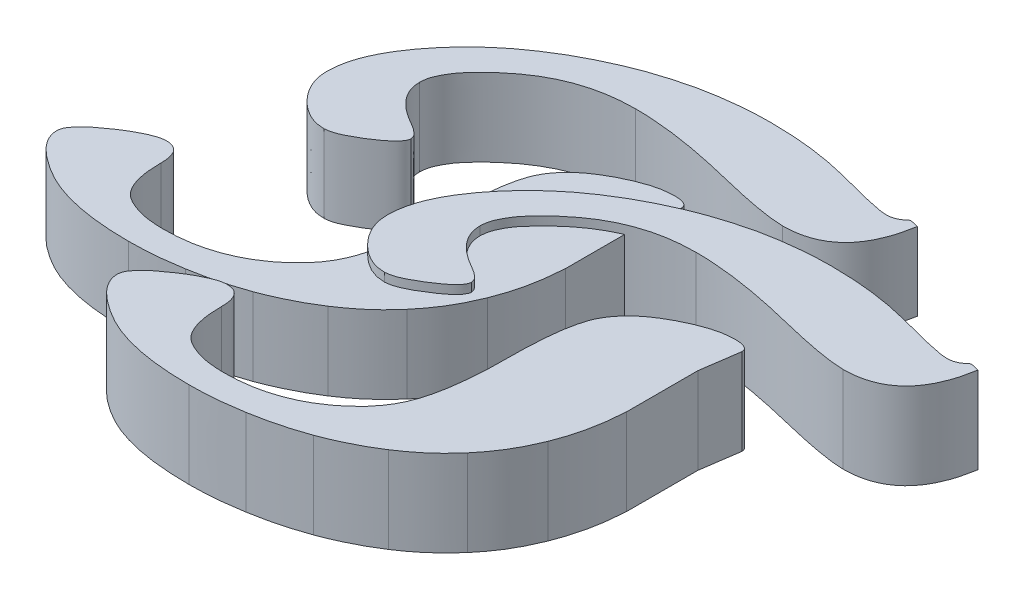
from build123d import *

# Parameters (mm, degrees)
BOSS_EXTRUDE2_DEPTH   = 10
BOSS_EXTRUDE2_2_DEPTH = 10
BOSS_EXTRUDE3_DEPTH   = 9
BOSS_EXTRUDE3_2_DEPTH = 9


with BuildPart() as part:
    # Sketch1 → Boss-Extrude2 (new body)
    with BuildSketch(Plane(origin=(0, 0, 0), x_dir=(1, 0, 0), z_dir=(0, 1, 0))):
        with BuildLine():
            add(Edge.make_bspline(
                [(32.296176809, 32.676124234), (32.238166261, 32.362750175), (32.125346395, 31.753295167), (31.918169907, 30.870525827), (31.653744835, 30.052202831), (31.351322074, 29.293060452), (31.011130686, 28.589829887), (30.613068251, 27.957544838), (30.191170658, 27.371792563), (29.713248528, 26.857596383), (29.196812469, 26.399925412), (28.63838919, 26.004028107), (28.039337987, 25.669588906), (27.397174124, 25.393875403), (26.712705678, 25.185777569), (25.986873606, 25.032502244), (25.219922734, 24.941268577), (24.692991994, 24.930278259), (24.423595327, 24.92465939)],
                knots=[0, 0, 0, 0, 1.249320145, 2.429698309, 3.551675932, 4.61703294, 5.631541448, 6.608758601, 7.542558368, 8.457255773, 9.354287334, 10.243528633, 11.135114158, 12.039099556, 12.977729995, 13.934803594, 14.944155299, 16, 16, 16, 16], degree=3))
            add(Edge.make_bspline(
                [(24.423595327, 24.92465939), (24.2081891, 24.93307122), (23.732838973, 24.951634122), (22.95055362, 25.022796258), (22.040399533, 25.162411786), (20.991771223, 25.328916324), (19.817026463, 25.570355284), (18.498698173, 25.836444366), (17.054739713, 26.175806838), (15.507320069, 26.53951355), (13.929672651, 26.930908015), (12.364380258, 27.242599757), (10.863260175, 27.536155799), (9.413743971, 27.75023441), (8.022376823, 27.942805655), (6.681141114, 28.054048965), (5.399486584, 28.147444936), (4.563997524, 28.152145267), (4.156744538, 28.154436408)],
                knots=[0, 0, 0, 0, 0.503062706, 1.110139311, 1.831901116, 2.651570933, 3.587805768, 4.63031373, 5.790272806, 7.049123854, 8.340346115, 9.583030205, 10.773416163, 11.909423871, 13.00214145, 14.05066393, 15.049810495, 16, 16, 16, 16], degree=3))
            add(Edge.make_bspline(
                [(4.156744538, 28.154436408), (3.651701269, 28.141436225), (2.659222586, 28.115889099), (1.19313467, 27.954436634), (-0.218090704, 27.672370302), (-1.581249437, 27.274490699), (-2.893580495, 26.77301407), (-4.151929459, 26.151760938), (-5.357914742, 25.423045614), (-6.486956607, 24.594864806), (-7.51920137, 23.725067489), (-8.441654616, 22.877774356), (-9.206562709, 22.042223287), (-9.863142886, 21.26068495), (-10.342789632, 20.478248024), (-10.707808789, 19.739462766), (-10.938462023, 19.020416481), (-10.968377124, 18.543975666), (-10.982835235, 18.313709556)],
                knots=[0, 0, 0, 0, 1.250848759, 2.458087861, 3.647715622, 4.810575582, 5.971134652, 7.122594925, 8.281507705, 9.45648421, 10.586275448, 11.623842744, 12.555425394, 13.390863396, 14.146904561, 14.821463036, 15.430407483, 16, 16, 16, 16], degree=3))
            add(Edge.make_bspline(
                [(-10.982835235, 18.313709556), (-10.970943304, 18.097141678), (-10.947336316, 17.66722703), (-10.762545972, 17.036673283), (-10.476345806, 16.422341503), (-10.068916509, 15.827835985), (-9.540944745, 15.25637466), (-8.902560688, 14.704714866), (-8.152281393, 14.167686331), (-7.597945077, 13.847772501), (-7.308963877, 13.680998145)],
                knots=[0, 0, 0, 0, 0.836688663, 1.66093289, 2.522757717, 3.45056617, 4.436450929, 5.524996317, 6.709755229, 8, 8, 8, 8], degree=3))
            add(Edge.make_bspline(
                [(-7.308963877, 13.680998145), (-7.084942257, 13.549664088), (-6.68512226, 13.315267148), (-6.220337144, 12.918834608), (-5.882592097, 12.555301125), (-5.835854191, 12.279066597), (-5.815192006, 12.156947115)],
                knots=[0, 0, 0, 0, 1.404279751, 2.506272058, 3.339643434, 4, 4, 4, 4], degree=3))
            add(Edge.make_bspline(
                [(-5.815192006, 12.156947115), (-5.824432421, 12.075104537), (-5.844045731, 11.901388968), (-5.970850083, 11.63841996), (-6.165230171, 11.360374661), (-6.427979686, 11.057589798), (-6.771933214, 10.743951559), (-7.180551318, 10.399286899), (-7.683090414, 10.053532041), (-8.398308473, 9.559576816), (-9.284127823, 9.034506197), (-10.258301808, 8.534890751), (-11.091297017, 8.213235145), (-11.613492601, 8.155112884), (-11.840744756, 8.129818895)],
                knots=[0, 0, 0, 0, 0.391847711, 0.831719262, 1.376672458, 2.01601642, 2.745194141, 3.602994313, 4.572767921, 5.662674314, 7.764525838, 9.493078839, 10.909023264, 12, 12, 12, 12], degree=3))
            add(Edge.make_bspline(
                [(-11.840744756, 8.129818895), (-12.180546023, 8.14936491), (-12.865478576, 8.188763534), (-13.855737001, 8.576684458), (-14.809218315, 9.163693135), (-15.689717813, 9.959429003), (-16.454604085, 10.880297187), (-17.022700194, 11.883331703), (-17.378647023, 12.934120706), (-17.421184052, 13.654801073), (-17.442389272, 14.0140689)],
                knots=[0, 0, 0, 0, 0.914633543, 1.843613749, 2.835295667, 3.930056909, 5.034776709, 6.056468476, 7.031126171, 8, 8, 8, 8], degree=3))
            add(Edge.make_bspline(
                [(-17.442389272, 14.0140689), (-17.42733724, 14.371530241), (-17.396582983, 15.101893971), (-17.186019114, 16.206746749), (-16.839182199, 17.332920035), (-16.346440911, 18.479856507), (-15.716779551, 19.648269093), (-14.953734689, 20.845223122), (-14.05250807, 22.062149823), (-13.031140743, 23.29469322), (-11.89654551, 24.509187236), (-10.665725852, 25.677795932), (-9.350238179, 26.792653216), (-7.945656674, 27.840635317), (-6.45655459, 28.828923043), (-4.890949982, 29.772273527), (-3.234675613, 30.647589018), (-1.505069273, 31.457893498), (0.269462317, 32.210938543), (2.090841778, 32.839992298), (3.929372689, 33.386332633), (5.786421911, 33.846248352), (7.668105581, 34.187313511), (9.568677063, 34.425698906), (11.491655122, 34.586151737), (12.782617546, 34.604671075), (13.432260412, 34.613990445)],
                knots=[0, 0, 0, 0, 0.641824347, 1.311373201, 2.012767159, 2.754530311, 3.54920331, 4.393952296, 5.301468113, 6.266888195, 7.267164367, 8.284268289, 9.31314753, 10.362002438, 11.429417095, 12.521527533, 13.643170267, 14.791825037, 15.950919461, 17.10312799, 18.250113145, 19.394565389, 20.536958502, 21.682032545, 22.83354388, 24, 24, 24, 24], degree=3))
            add(Edge.make_bspline(
                [(13.432260412, 34.613990445), (14.300861008, 34.598953549), (16.017941877, 34.569228073), (18.556646898, 34.318369937), (21.026570305, 33.922142118), (23.011336189, 33.438493456), (24.513226125, 33.02829508), (25.528604405, 32.762924255), (26.430960989, 32.543427092), (27.224124501, 32.357774042), (27.907309121, 32.21580575), (28.479453838, 32.115579137), (28.940291138, 32.046272547), (29.210904031, 32.035056179), (29.328819174, 32.03016883)],
                knots=[0, 0, 0, 0, 1.934990464, 3.82515868, 5.678685825, 7.504245759, 8.373435701, 9.147995091, 9.842531944, 10.442615453, 10.963059397, 11.396877843, 11.737199382, 12, 12, 12, 12], degree=3))
            add(Edge.make_bspline(
                [(29.328819174, 32.03016883), (29.498175031, 32.039991977), (29.829586266, 32.059214821), (30.307339777, 32.208731111), (30.751097845, 32.448794741), (30.992490795, 32.686441072), (31.115289587, 32.807333925)],
                knots=[0, 0, 0, 0, 1.012239635, 1.980844312, 2.972837109, 4, 4, 4, 4], degree=3))
            Line((31.115289587, 32.807333925), (31.37770897, 32.877985297))
            Line((31.37770897, 32.877985297), (32.296176809, 32.676124234))
        make_face()
    extrude(amount=BOSS_EXTRUDE2_DEPTH)


with BuildPart() as body_2:
    # Sketch1 → Boss-Extrude2 2 (new body)
    with BuildSketch(Plane(origin=(0, 0, 0), x_dir=(1, 0, 0), z_dir=(0, 1, 0))):
        with BuildLine():
            add(Edge.make_bspline(
                [(15.127893347, 21.694882372), (15.371874828, 21.688748966), (15.799774863, 21.677992067), (16.343160786, 21.533642548), (16.734760258, 21.255529225), (16.77427564, 20.986378989), (16.793247122, 20.857158958)],
                knots=[0, 0, 0, 0, 1.412379978, 2.477062757, 3.268832157, 4, 4, 4, 4], degree=3))
            Line((16.793247122, 20.857158958), (16.147291718, 16.396029451))
            Line((16.147291718, 16.396029451), (16.147291718, 8.109632789))
            add(Edge.make_bspline(
                [(16.147291718, 8.109632789), (16.097109518, 7.445688333), (15.998050209, 6.135066664), (15.672169815, 4.216989089), (15.201982666, 2.37512701), (14.768033341, 1.202676892), (14.552589315, 0.620587328)],
                knots=[0, 0, 0, 0, 1.038589385, 2.050168118, 3.031961554, 4, 4, 4, 4], degree=3))
            add(Edge.make_bspline(
                [(14.552589315, 0.620587328), (14.328106577, 0.098882428), (13.879824016, -0.942940257), (13.070657676, -2.439918422), (12.130133637, -3.861519856), (11.411222571, -4.741255192), (11.050299861, -5.182918252)],
                knots=[0, 0, 0, 0, 1.000725729, 1.998407084, 2.995118626, 4, 4, 4, 4], degree=3))
            add(Edge.make_bspline(
                [(11.050299861, -5.182918252), (10.699888853, -5.579153015), (9.994519653, -6.376764367), (8.813464341, -7.473386283), (7.542414973, -8.51098598), (6.627829585, -9.129408667), (6.165262121, -9.442186695)],
                knots=[0, 0, 0, 0, 0.975523019, 1.963705119, 2.970108456, 4, 4, 4, 4], degree=3))
            add(Edge.make_bspline(
                [(6.165262121, -9.442186695), (5.718258972, -9.724694938), (4.820680779, -10.291968881), (3.391056744, -11.029756076), (1.917782929, -11.736925477), (0.889595167, -12.130576373), (0.371849595, -12.328799905)],
                knots=[0, 0, 0, 0, 0.977965645, 1.963745983, 2.97464107, 4, 4, 4, 4], degree=3))
            add(Edge.make_bspline(
                [(0.371849595, -12.328799905), (-0.124370529, -12.502382937), (-1.119305532, -12.850421694), (-2.651429148, -13.277897584), (-4.214977317, -13.659392132), (-5.279080701, -13.848442163), (-5.815192006, -13.943688414)],
                knots=[0, 0, 0, 0, 0.985008729, 1.974969608, 2.979759202, 4, 4, 4, 4], degree=3))
            add(Edge.make_bspline(
                [(-5.815192006, -13.943688414), (-6.822500333, -14.100970914), (-8.839193246, -14.415860103), (-10.879899471, -14.457685836), (-11.901303075, -14.478620233)],
                knots=[0, 0, 0, 0, 0.998970464, 2, 2, 2, 2], degree=3))
            add(Edge.make_bspline(
                [(-11.901303075, -14.478620233), (-12.480176912, -14.470704678), (-13.605376856, -14.455318627), (-15.245514821, -14.341092255), (-16.790118121, -14.167032707), (-18.238666331, -13.901732605), (-19.591594707, -13.572339406), (-20.852245827, -13.17012168), (-22.013837238, -12.687050329), (-23.070328177, -12.132969476), (-24.006837082, -11.540551764), (-24.829943482, -10.954997509), (-25.533639973, -10.380517366), (-26.115319952, -9.808167194), (-26.566696045, -9.232111356), (-26.88704443, -8.657431651), (-27.09606742, -8.087129986), (-27.120102644, -7.701036125), (-27.131720326, -7.514413537)],
                knots=[0, 0, 0, 0, 1.549572055, 3.012017952, 4.399547498, 5.708621745, 6.951579616, 8.125080993, 9.247455168, 10.315044149, 11.314626066, 12.211912658, 13.018000142, 13.744032161, 14.392577437, 14.969076894, 15.501692315, 16, 16, 16, 16], degree=3))
            add(Edge.make_bspline(
                [(-27.131720326, -7.514413537), (-27.119397318, -7.402464672), (-27.093289348, -7.165285776), (-26.953194025, -6.802117718), (-26.708511655, -6.42954706), (-26.389048435, -6.025457225), (-25.959413112, -5.614415269), (-25.463644018, -5.154545737), (-24.848568344, -4.701998651), (-24.185178917, -4.215444526), (-23.488546491, -3.758656575), (-22.818025608, -3.343117454), (-22.189357695, -3.00026196), (-21.612264135, -2.712463449), (-21.076388518, -2.48886483), (-20.585363959, -2.323877072), (-20.134377745, -2.226113922), (-19.848294605, -2.212085769), (-19.713326238, -2.205467563)],
                knots=[0, 0, 0, 0, 0.566881924, 1.201016451, 1.940959198, 2.810984592, 3.79578647, 4.938294616, 6.222386566, 7.645938048, 9.092106944, 10.426219881, 11.627197781, 12.705806991, 13.680450689, 14.555929804, 15.318716242, 16, 16, 16, 16], degree=3))
            add(Edge.make_bspline(
                [(-19.713326238, -2.205467563), (-19.567756497, -2.212500373), (-19.28786173, -2.226022736), (-18.899802193, -2.347921951), (-18.570277337, -2.548410677), (-18.297085473, -2.830249838), (-18.103714222, -3.204484362), (-17.946926431, -3.641069834), (-17.874008167, -4.161249804), (-17.862435782, -4.530111541), (-17.856204452, -4.728730859)],
                knots=[0, 0, 0, 0, 0.977841989, 1.880149377, 2.703424499, 3.552150342, 4.484636058, 5.515814062, 6.66235159, 8, 8, 8, 8], degree=3))
            add(Edge.make_bspline(
                [(-17.856204452, -4.728730859), (-17.849965839, -5.055230132), (-17.838046831, -5.679014256), (-17.760498913, -6.570257736), (-17.62256031, -7.371840513), (-17.421099779, -8.086415186), (-17.163522762, -8.712330982), (-16.845320731, -9.250487018), (-16.475700966, -9.700841185), (-15.882741313, -10.169635981), (-15.015814884, -10.595277188), (-13.860795012, -10.990361518), (-12.544639958, -11.201588832), (-11.619346354, -11.232589896), (-11.134231033, -11.248843214)],
                knots=[0, 0, 0, 0, 1.074446753, 2.052754419, 2.941029153, 3.747044831, 4.491390682, 5.161649512, 5.798139074, 6.396408736, 7.634485015, 8.954407516, 10.403248907, 12, 12, 12, 12], degree=3))
            add(Edge.make_bspline(
                [(-11.134231033, -11.248843214), (-10.72685375, -11.240735719), (-9.924045113, -11.224758474), (-8.741220117, -11.10889463), (-7.591620721, -10.935105456), (-6.489216835, -10.654942346), (-5.416365796, -10.326138362), (-4.387644211, -9.905725712), (-3.38578082, -9.429382119), (-2.443046275, -8.857487386), (-1.551516122, -8.250105405), (-0.729731393, -7.604661241), (0.008677127, -6.919802271), (0.690204701, -6.223405259), (1.271798923, -5.477401838), (1.798860659, -4.720118382), (2.225818541, -3.919415263), (2.60238071, -3.085915616), (2.9012705, -2.184003472), (3.166276494, -1.197035182), (3.382749473, -0.110782104), (3.564269173, 1.074642102), (3.703544954, 2.357765076), (3.802160069, 3.738069737), (3.86367673, 5.219098277), (3.874302319, 6.760512157), (3.88365065, 8.291934929), (3.947898049, 9.732183269), (4.033208871, 11.048979408), (4.162584528, 12.237977132), (4.329136667, 13.300492472), (4.543503005, 14.232972705), (4.776382253, 15.043974057), (5.156210727, 15.960092682), (5.809003259, 16.978556756), (6.809241921, 18.088943472), (8.07726221, 19.089770226), (9.53120101, 19.96876657), (11.042402812, 20.714840161), (12.497469683, 21.267229919), (13.84632378, 21.619313374), (14.715655197, 21.670574348), (15.127893347, 21.694882372)],
                knots=[0, 0, 0, 0, 1.015125314, 2.000483102, 2.959920622, 3.909636101, 4.832506888, 5.754272371, 6.676800275, 7.594246183, 8.498959351, 9.364554068, 10.195377292, 11.007846263, 11.789621579, 12.550108005, 13.30428169, 14.047515556, 14.827084435, 15.669128977, 16.593293953, 17.585867451, 18.657198543, 19.808983909, 21.034210445, 22.350744211, 23.650509584, 24.850603124, 25.943247275, 26.938650033, 27.83052752, 28.621778163, 29.322104324, 29.93097632, 31.087300309, 32.316336844, 33.640246206, 35.097021958, 36.544501828, 37.834030638, 38.97289436, 40, 40, 40, 40], degree=3))
        make_face()
    extrude(amount=BOSS_EXTRUDE2_2_DEPTH)


with BuildPart() as body_3:
    # Sketch2 → Boss-Extrude3 (new body)
    with BuildSketch(Plane(origin=(0, 0, 0), x_dir=(1, 0, 0), z_dir=(0, 1, 0))):
        with BuildLine():
            add(Edge.make_bspline(
                [(13.400044479, 44.562090394), (13.342033931, 44.248716336), (13.229214065, 43.639261327), (13.022037577, 42.756491987), (12.757612505, 41.938168991), (12.455189744, 41.179026612), (12.114998356, 40.475796047), (11.716935921, 39.843510999), (11.295038328, 39.257758724), (10.817116198, 38.743562543), (10.300680139, 38.285891572), (9.74225686, 37.889994268), (9.143205658, 37.555555066), (8.501041794, 37.279841563), (7.816573348, 37.071743729), (7.090741277, 36.918468404), (6.323790404, 36.827234737), (5.796859665, 36.81624442), (5.527462998, 36.81062555)],
                knots=[0, 0, 0, 0, 1.249320145, 2.429698309, 3.551675932, 4.61703294, 5.631541448, 6.608758601, 7.542558368, 8.457255773, 9.354287334, 10.243528633, 11.135114158, 12.039099556, 12.977729995, 13.934803594, 14.944155299, 16, 16, 16, 16], degree=3))
            add(Edge.make_bspline(
                [(5.527462998, 36.81062555), (5.31205677, 36.819037381), (4.836706643, 36.837600282), (4.05442129, 36.908762419), (3.144267203, 37.048377946), (2.095638894, 37.214882484), (0.920894133, 37.456321444), (-0.397434156, 37.722410527), (-1.841392617, 38.061772998), (-3.38881226, 38.42547971), (-4.966459679, 38.816874175), (-6.531752072, 39.128565918), (-8.032872154, 39.422121959), (-9.482388359, 39.63620057), (-10.873755507, 39.828771815), (-12.214991216, 39.940015126), (-13.496645746, 40.033411097), (-14.332134805, 40.038111427), (-14.739387792, 40.040402568)],
                knots=[0, 0, 0, 0, 0.503062706, 1.110139311, 1.831901116, 2.651570933, 3.587805768, 4.63031373, 5.790272806, 7.049123854, 8.340346115, 9.583030205, 10.773416163, 11.909423871, 13.00214145, 14.05066393, 15.049810495, 16, 16, 16, 16], degree=3))
            add(Edge.make_bspline(
                [(-14.739387792, 40.040402568), (-15.244431061, 40.027402386), (-16.236909743, 40.00185526), (-17.70299766, 39.840402794), (-19.114223034, 39.558336463), (-20.477381767, 39.160456859), (-21.789712825, 38.658980231), (-23.048061789, 38.037727099), (-24.254047071, 37.309011775), (-25.383088937, 36.480830966), (-26.4153337, 35.611033649), (-27.337786945, 34.763740516), (-28.102695039, 33.928189448), (-28.759275216, 33.14665111), (-29.238921962, 32.364214184), (-29.603941118, 31.625428927), (-29.834594352, 30.906382641), (-29.864509454, 30.429941827), (-29.878967565, 30.199675716)],
                knots=[0, 0, 0, 0, 1.250848759, 2.458087861, 3.647715622, 4.810575582, 5.971134652, 7.122594925, 8.281507705, 9.45648421, 10.586275448, 11.623842744, 12.555425394, 13.390863396, 14.146904561, 14.821463036, 15.430407483, 16, 16, 16, 16], degree=3))
            add(Edge.make_bspline(
                [(-29.878967565, 30.199675716), (-29.867075634, 29.983107838), (-29.843468645, 29.55319319), (-29.658678302, 28.922639443), (-29.372478136, 28.308307663), (-28.965048839, 27.713802146), (-28.437077075, 27.142340821), (-27.798693017, 26.590681027), (-27.048413723, 26.053652491), (-26.494077406, 25.733738662), (-26.205096207, 25.566964305)],
                knots=[0, 0, 0, 0, 0.836688663, 1.66093289, 2.522757717, 3.45056617, 4.436450929, 5.524996317, 6.709755229, 8, 8, 8, 8], degree=3))
            add(Edge.make_bspline(
                [(-26.205096207, 25.566964305), (-25.981074587, 25.435630249), (-25.58125459, 25.201233309), (-25.116469474, 24.804800768), (-24.778724427, 24.441267285), (-24.731986521, 24.165032758), (-24.711324336, 24.042913275)],
                knots=[0, 0, 0, 0, 1.404279751, 2.506272058, 3.339643434, 4, 4, 4, 4], degree=3))
            add(Edge.make_bspline(
                [(-24.711324336, 24.042913275), (-24.72056475, 23.961070698), (-24.740178061, 23.787355129), (-24.866982412, 23.52438612), (-25.0613625, 23.246340822), (-25.324112015, 22.943555958), (-25.668065543, 22.629917719), (-26.076683648, 22.28525306), (-26.579222743, 21.939498201), (-27.294440802, 21.445542976), (-28.180260153, 20.920472357), (-29.154434138, 20.420856911), (-29.987429347, 20.099201306), (-30.509624931, 20.041079044), (-30.736877085, 20.015785055)],
                knots=[0, 0, 0, 0, 0.391847711, 0.831719262, 1.376672458, 2.01601642, 2.745194141, 3.602994313, 4.572767921, 5.662674314, 7.764525838, 9.493078839, 10.909023264, 12, 12, 12, 12], degree=3))
            add(Edge.make_bspline(
                [(-30.736877085, 20.015785055), (-31.076678353, 20.035331071), (-31.761610906, 20.074729694), (-32.75186933, 20.462650618), (-33.705350645, 21.049659295), (-34.585850142, 21.845395164), (-35.350736415, 22.766263347), (-35.918832524, 23.769297863), (-36.274779353, 24.820086867), (-36.317316381, 25.540767234), (-36.338521601, 25.90003506)],
                knots=[0, 0, 0, 0, 0.914633543, 1.843613749, 2.835295667, 3.930056909, 5.034776709, 6.056468476, 7.031126171, 8, 8, 8, 8], degree=3))
            add(Edge.make_bspline(
                [(-36.338521601, 25.90003506), (-36.32346957, 26.257496402), (-36.292715312, 26.987860131), (-36.082151443, 28.09271291), (-35.735314529, 29.218886195), (-35.242573241, 30.365822668), (-34.612911881, 31.534235253), (-33.849867019, 32.731189282), (-32.9486404, 33.948115983), (-31.927273073, 35.18065938), (-30.792677839, 36.395153396), (-29.561858181, 37.563762093), (-28.246370509, 38.678619377), (-26.841789004, 39.726601477), (-25.35268692, 40.714889204), (-23.787082312, 41.658239688), (-22.130807943, 42.533555179), (-20.401201602, 43.343859658), (-18.626670013, 44.096904704), (-16.805290551, 44.725958459), (-14.966759641, 45.272298793), (-13.109710419, 45.732214512), (-11.228026748, 46.073279671), (-9.327455267, 46.311665066), (-7.404477207, 46.472117898), (-6.113514784, 46.490637235), (-5.463871918, 46.499956605)],
                knots=[0, 0, 0, 0, 0.641824347, 1.311373201, 2.012767159, 2.754530311, 3.54920331, 4.393952296, 5.301468113, 6.266888195, 7.267164367, 8.284268289, 9.31314753, 10.362002438, 11.429417095, 12.521527533, 13.643170267, 14.791825037, 15.950919461, 17.10312799, 18.250113145, 19.394565389, 20.536958502, 21.682032545, 22.83354388, 24, 24, 24, 24], degree=3))
            add(Edge.make_bspline(
                [(-5.463871918, 46.499956605), (-4.595271322, 46.484919709), (-2.878190452, 46.455194233), (-0.339485432, 46.204336097), (2.130437975, 45.808108278), (4.115203859, 45.324459616), (5.617093795, 44.914261241), (6.632472075, 44.648890416), (7.534828659, 44.429393253), (8.327992172, 44.243740202), (9.011176792, 44.101771911), (9.583321508, 44.001545298), (10.044158809, 43.932238707), (10.314771701, 43.921022339), (10.432686844, 43.91613499)],
                knots=[0, 0, 0, 0, 1.934990464, 3.82515868, 5.678685825, 7.504245759, 8.373435701, 9.147995091, 9.842531944, 10.442615453, 10.963059397, 11.396877843, 11.737199382, 12, 12, 12, 12], degree=3))
            add(Edge.make_bspline(
                [(10.432686844, 43.91613499), (10.602042702, 43.925958137), (10.933453936, 43.945180981), (11.411207447, 44.094697272), (11.854965515, 44.334760901), (12.096358465, 44.572407232), (12.219157257, 44.693300085)],
                knots=[0, 0, 0, 0, 1.012239635, 1.980844312, 2.972837109, 4, 4, 4, 4], degree=3))
            Line((12.219157257, 44.693300085), (12.48157664, 44.763951458))
            Line((12.48157664, 44.763951458), (13.400044479, 44.562090394))
        make_face()
    extrude(amount=BOSS_EXTRUDE3_DEPTH)


with BuildPart() as body_4:
    # Sketch2 → Boss-Extrude3 2 (new body)
    with BuildSketch(Plane(origin=(0, 0, 0), x_dir=(1, 0, 0), z_dir=(0, 1, 0))):
        with BuildLine():
            add(Edge.make_bspline(
                [(-3.768238983, 33.580848532), (-3.524257501, 33.574715127), (-3.096357467, 33.563958227), (-2.552971544, 33.419608708), (-2.161372072, 33.141495385), (-2.12185669, 32.872345149), (-2.102885208, 32.743125118)],
                knots=[0, 0, 0, 0, 1.412379978, 2.477062757, 3.268832157, 4, 4, 4, 4], degree=3))
            Line((-2.102885208, 32.743125118), (-2.748840612, 28.281995611))
            Line((-2.748840612, 28.281995611), (-2.748840612, 19.995598949))
            add(Edge.make_bspline(
                [(-2.748840612, 19.995598949), (-2.799022812, 19.331654494), (-2.898082121, 18.021032824), (-3.223962515, 16.10295525), (-3.694149664, 14.26109317), (-4.128098989, 13.088643052), (-4.343543014, 12.506553488)],
                knots=[0, 0, 0, 0, 1.038589385, 2.050168118, 3.031961554, 4, 4, 4, 4], degree=3))
            add(Edge.make_bspline(
                [(-4.343543014, 12.506553488), (-4.568025752, 11.984848589), (-5.016308314, 10.943025903), (-5.825474654, 9.446047738), (-6.765998693, 8.024446304), (-7.484909759, 7.144710968), (-7.845832469, 6.703047908)],
                knots=[0, 0, 0, 0, 1.000725729, 1.998407084, 2.995118626, 4, 4, 4, 4], degree=3))
            add(Edge.make_bspline(
                [(-7.845832469, 6.703047908), (-8.196243477, 6.306813145), (-8.901612676, 5.509201794), (-10.082667989, 4.412579878), (-11.353717356, 3.374980181), (-12.268302745, 2.756557493), (-12.730870209, 2.443779466)],
                knots=[0, 0, 0, 0, 0.975523019, 1.963705119, 2.970108456, 4, 4, 4, 4], degree=3))
            add(Edge.make_bspline(
                [(-12.730870209, 2.443779466), (-13.177873357, 2.161271222), (-14.075451551, 1.59399728), (-15.505075585, 0.856210085), (-16.978349401, 0.149040683), (-18.006537162, -0.244610213), (-18.524282735, -0.442833744)],
                knots=[0, 0, 0, 0, 0.977965645, 1.963745983, 2.97464107, 4, 4, 4, 4], degree=3))
            add(Edge.make_bspline(
                [(-18.524282735, -0.442833744), (-19.020502859, -0.616416777), (-20.015437862, -0.964455533), (-21.547561478, -1.391931423), (-23.111109647, -1.773425972), (-24.175213031, -1.962476002), (-24.711324336, -2.057722254)],
                knots=[0, 0, 0, 0, 0.985008729, 1.974969608, 2.979759202, 4, 4, 4, 4], degree=3))
            add(Edge.make_bspline(
                [(-24.711324336, -2.057722254), (-25.718632663, -2.215004753), (-27.735325575, -2.529893943), (-29.776031801, -2.571719675), (-30.797435404, -2.592654072)],
                knots=[0, 0, 0, 0, 0.998970464, 2, 2, 2, 2], degree=3))
            add(Edge.make_bspline(
                [(-30.797435404, -2.592654072), (-31.376309242, -2.584738517), (-32.501509186, -2.569352467), (-34.141647151, -2.455126095), (-35.686250451, -2.281066546), (-37.13479866, -2.015766445), (-38.487727037, -1.686373246), (-39.748378157, -1.28415552), (-40.909969568, -0.801084168), (-41.966460506, -0.247003316), (-42.902969412, 0.345414397), (-43.726075812, 0.930968651), (-44.429772303, 1.505448794), (-45.011452281, 2.077798966), (-45.462828374, 2.653854804), (-45.783176759, 3.22853451), (-45.99219975, 3.798836174), (-46.016234974, 4.184930035), (-46.027852656, 4.371552623)],
                knots=[0, 0, 0, 0, 1.549572055, 3.012017952, 4.399547498, 5.708621745, 6.951579616, 8.125080993, 9.247455168, 10.315044149, 11.314626066, 12.211912658, 13.018000142, 13.744032161, 14.392577437, 14.969076894, 15.501692315, 16, 16, 16, 16], degree=3))
            add(Edge.make_bspline(
                [(-46.027852656, 4.371552623), (-46.015529647, 4.483501488), (-45.989421677, 4.720680384), (-45.849326355, 5.083848442), (-45.604643985, 5.456419101), (-45.285180765, 5.860508935), (-44.855545442, 6.271550892), (-44.359776348, 6.731420424), (-43.744700673, 7.183967509), (-43.081311247, 7.670521634), (-42.38467882, 8.127309586), (-41.714157938, 8.542848706), (-41.085490025, 8.8857042), (-40.508396464, 9.173502711), (-39.972520847, 9.39710133), (-39.481496288, 9.562089088), (-39.030510074, 9.659852238), (-38.744426935, 9.673880392), (-38.609458567, 9.680498597)],
                knots=[0, 0, 0, 0, 0.566881924, 1.201016451, 1.940959198, 2.810984592, 3.79578647, 4.938294616, 6.222386566, 7.645938048, 9.092106944, 10.426219881, 11.627197781, 12.705806991, 13.680450689, 14.555929804, 15.318716242, 16, 16, 16, 16], degree=3))
            add(Edge.make_bspline(
                [(-38.609458567, 9.680498597), (-38.463888827, 9.673465787), (-38.18399406, 9.659943425), (-37.795934522, 9.53804421), (-37.466409667, 9.337555484), (-37.193217802, 9.055716322), (-36.999846551, 8.681481798), (-36.843058761, 8.244896327), (-36.770140497, 7.724716356), (-36.758568112, 7.355854619), (-36.752336782, 7.157235302)],
                knots=[0, 0, 0, 0, 0.977841989, 1.880149377, 2.703424499, 3.552150342, 4.484636058, 5.515814062, 6.66235159, 8, 8, 8, 8], degree=3))
            add(Edge.make_bspline(
                [(-36.752336782, 7.157235302), (-36.746098169, 6.830736028), (-36.734179161, 6.206951905), (-36.656631243, 5.315708424), (-36.51869264, 4.514125647), (-36.317232109, 3.799550975), (-36.059655091, 3.173635178), (-35.74145306, 2.635479143), (-35.371833296, 2.185124976), (-34.778873642, 1.716330179), (-33.911947213, 1.290688972), (-32.756927342, 0.895604642), (-31.440772288, 0.684377328), (-30.515478683, 0.653376264), (-30.030363363, 0.637122946)],
                knots=[0, 0, 0, 0, 1.074446753, 2.052754419, 2.941029153, 3.747044831, 4.491390682, 5.161649512, 5.798139074, 6.396408736, 7.634485015, 8.954407516, 10.403248907, 12, 12, 12, 12], degree=3))
            add(Edge.make_bspline(
                [(-30.030363363, 0.637122946), (-29.62298608, 0.645230441), (-28.820177443, 0.661207686), (-27.637352447, 0.777071531), (-26.48775305, 0.950860704), (-25.385349164, 1.231023814), (-24.312498126, 1.559827799), (-23.283776541, 1.980240448), (-22.28191315, 2.456584041), (-21.339178604, 3.028478774), (-20.447648452, 3.635860756), (-19.625863723, 4.281304919), (-18.887455202, 4.966163889), (-18.205927629, 5.662560902), (-17.624333407, 6.408564323), (-17.097271671, 7.165847778), (-16.670313789, 7.966550897), (-16.293751619, 8.800050544), (-15.99486183, 9.701962688), (-15.729855835, 10.688930979), (-15.513382857, 11.775184056), (-15.331863157, 12.960608263), (-15.192587376, 14.243731236), (-15.09397226, 15.624035897), (-15.0324556, 17.105064437), (-15.021830011, 18.646478317), (-15.01248168, 20.17790109), (-14.94823428, 21.618149429), (-14.862923459, 22.934945569), (-14.733547802, 24.123943293), (-14.566995663, 25.186458632), (-14.352629325, 26.118938866), (-14.119750077, 26.929940218), (-13.739921602, 27.846058842), (-13.087129071, 28.864522916), (-12.086890409, 29.974909632), (-10.81887012, 30.975736387), (-9.36493132, 31.85473273), (-7.853729518, 32.600806321), (-6.398662647, 33.153196079), (-5.04980855, 33.505279534), (-4.180477132, 33.556540508), (-3.768238983, 33.580848532)],
                knots=[0, 0, 0, 0, 1.015125314, 2.000483102, 2.959920622, 3.909636101, 4.832506888, 5.754272371, 6.676800275, 7.594246183, 8.498959351, 9.364554068, 10.195377292, 11.007846263, 11.789621579, 12.550108005, 13.30428169, 14.047515556, 14.827084435, 15.669128977, 16.593293953, 17.585867451, 18.657198543, 19.808983909, 21.034210445, 22.350744211, 23.650509584, 24.850603124, 25.943247275, 26.938650033, 27.83052752, 28.621778163, 29.322104324, 29.93097632, 31.087300309, 32.316336844, 33.640246206, 35.097021958, 36.544501828, 37.834030638, 38.97289436, 40, 40, 40, 40], degree=3))
        make_face()
    extrude(amount=BOSS_EXTRUDE3_2_DEPTH)


solid = Compound([part.part, body_2.part, body_3.part, body_4.part])
